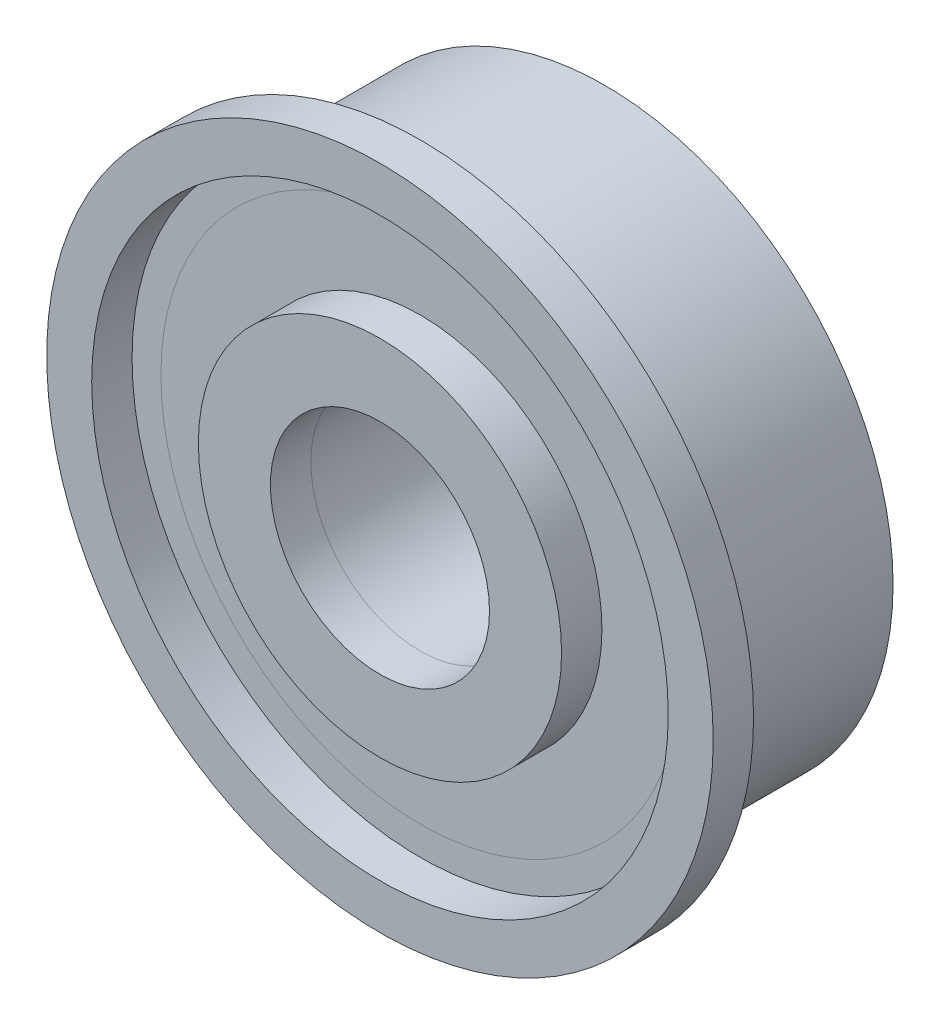
from build123d import *

# Parameters (mm, degrees)
SKETCH_1_R      = 3.15
SKETCH_1_R_2    = 1.9
EXTRUDE_1_DEPTH = 3.2
SKETCH_2_R      = 5
SKETCH_2_R_2    = 4.5
EXTRUDE_2_DEPTH = 3.2
SKETCH_3_R      = 4.5
SKETCH_3_R_2    = 3.15
EXTRUDE_4_DEPTH = 3.2
SKETCH_4_R      = 5.78
SKETCH_4_R_2    = 5
EXTRUDE_6_DEPTH = 0.7
SKETCH_5_R      = 3.15
SKETCH_5_R_2    = 1.9
EXTRUDE_7_DEPTH = 0.7


with BuildPart() as part:
    # 草图1 → 凸台-拉伸1 (new body)
    with BuildSketch(Plane.XY):
        Circle(SKETCH_1_R)
        Circle(SKETCH_1_R_2, mode=Mode.SUBTRACT)
    extrude(amount=EXTRUDE_1_DEPTH)


with BuildPart() as body_2:
    # 草图2 → 凸台-拉伸2 (new body)
    with BuildSketch(Plane.XY.offset(3.2)):
        Circle(SKETCH_2_R)
        Circle(SKETCH_2_R_2, mode=Mode.SUBTRACT)
    extrude(amount=-EXTRUDE_2_DEPTH)


with BuildPart() as body_3:
    # 草图3 → 凸台-拉伸4 (new body)
    with BuildSketch(Plane.XY.offset(3.2)):
        Circle(SKETCH_3_R)
        Circle(SKETCH_3_R_2, mode=Mode.SUBTRACT)
    extrude(amount=-EXTRUDE_4_DEPTH)


with BuildPart() as body_4:
    # 草图4 → 凸台-拉伸6 (new body)
    with BuildSketch(Plane.XY.offset(3.2)):
        Circle(SKETCH_4_R)
        Circle(SKETCH_4_R_2, mode=Mode.SUBTRACT)
    extrude(amount=EXTRUDE_6_DEPTH)


with BuildPart() as body_5:
    # 草图5 → 凸台-拉伸7 (new body)
    with BuildSketch(Plane.XY.offset(3.2)):
        Circle(SKETCH_5_R)
        Circle(SKETCH_5_R_2, mode=Mode.SUBTRACT)
    extrude(amount=EXTRUDE_7_DEPTH)


solid = Compound([part.part, body_2.part, body_3.part, body_4.part, body_5.part])
